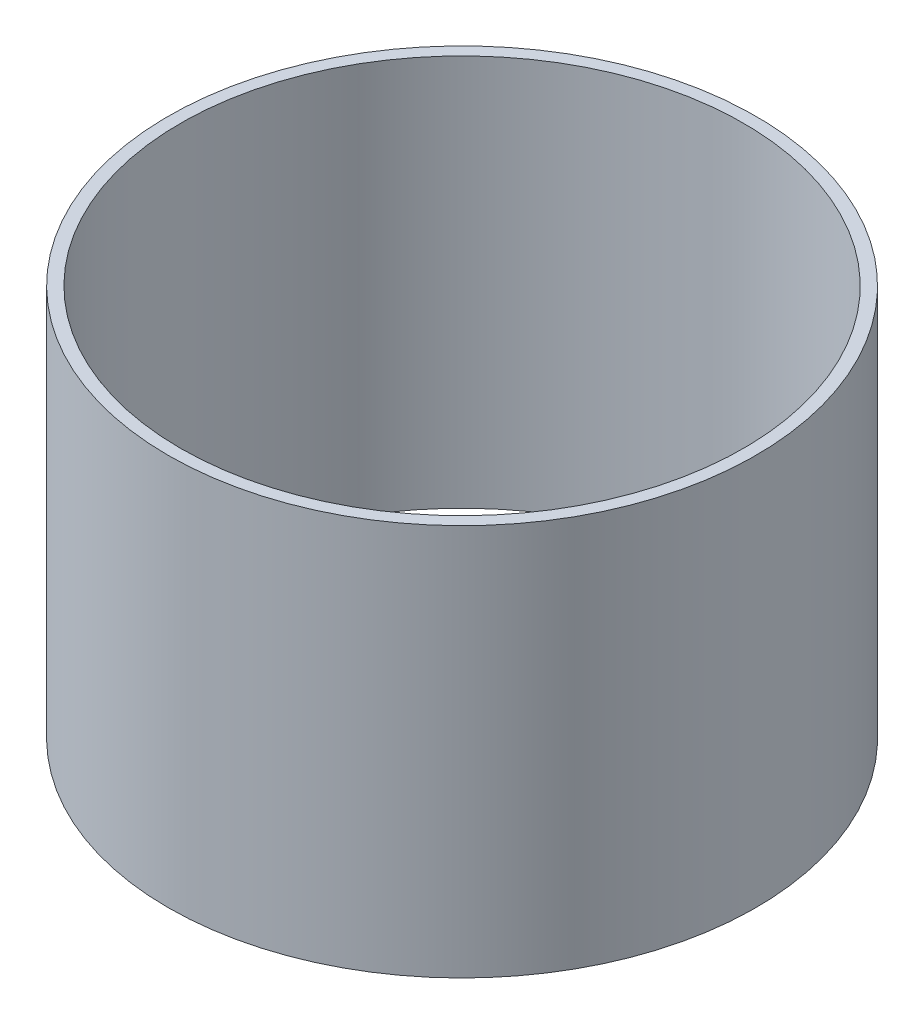
from build123d import *

# Parameters (mm, degrees)
SKETCH1_R           = 76.2
SKETCH1_R_2         = 73.025
BOSS_EXTRUDE1_DEPTH = 101.6


with BuildPart() as part:
    # Sketch1 → Boss-Extrude1 (new body)
    with BuildSketch(Plane(origin=(0, 0, 0), x_dir=(1, 0, 0), z_dir=(0, 1, 0))):
        with Locations(Location((0, 0, 0), (0, 0, 270))):
            Circle(SKETCH1_R)
        with Locations(Location((0, 0, 0), (0, 0, 270))):
            Circle(SKETCH1_R_2, mode=Mode.SUBTRACT)
    extrude(amount=BOSS_EXTRUDE1_DEPTH)


solid = part.part
